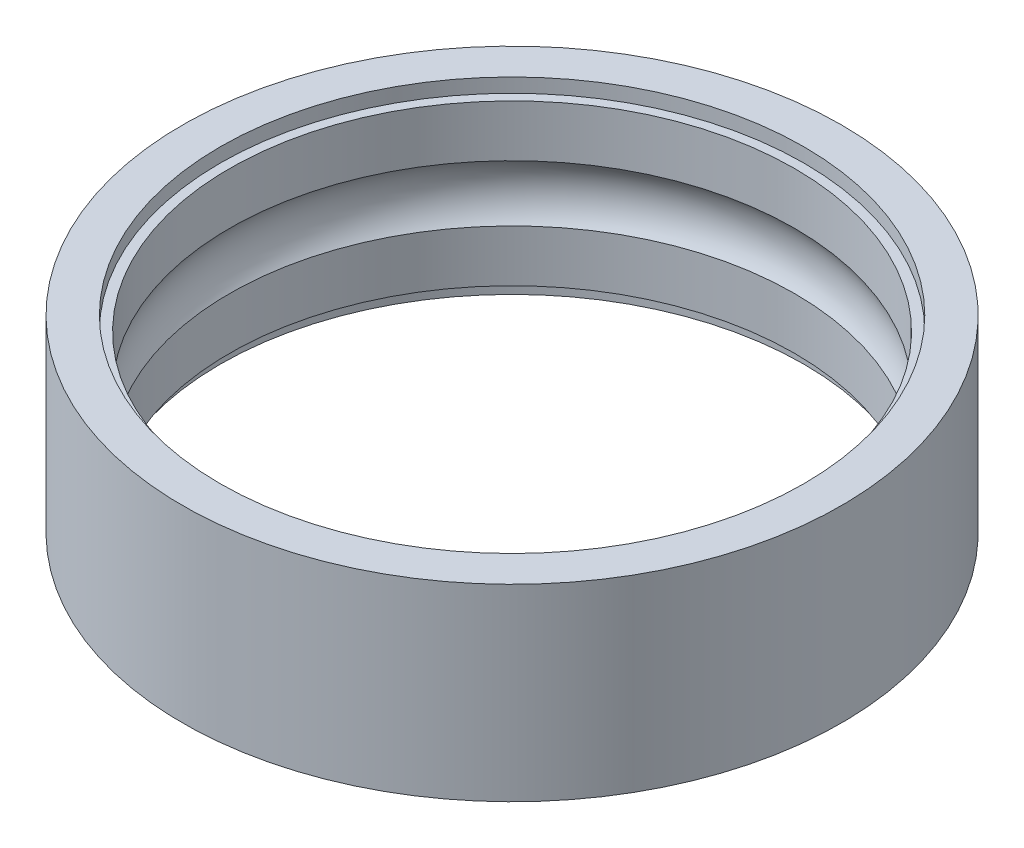
from build123d import *


with BuildPart() as part:
    # Sketch1 → Revolve1 (revolve)
    with BuildSketch(Plane.XY, mode=Mode.PRIVATE) as revolve1_sk:
        with BuildLine():
            Line((15, 4.25), (15, 1.5))
            ThreePointArc((15, 1.5), (15.5, 0), (15, -1.5))
            Line((15, -1.5), (15, -4.25))
            Line((15, -4.25), (15.496238558, -4.25))
            Line((15.496238558, -4.25), (15.496238558, -5))
            Line((15.496238558, -5), (17.5, -5))
            Line((17.5, -5), (17.5, 5))
            Line((17.5, 5), (15.496238558, 5))
            Line((15.496238558, 5), (15.496238558, 4.25))
            Line((15.496238558, 4.25), (15, 4.25))
        make_face()
    revolve(revolve1_sk.sketch.rotate(Axis((0, 0, 0), (0, 1, 0)), 90), axis=Axis((0, 0, 0), (0, 1, 0)))


solid = part.part
